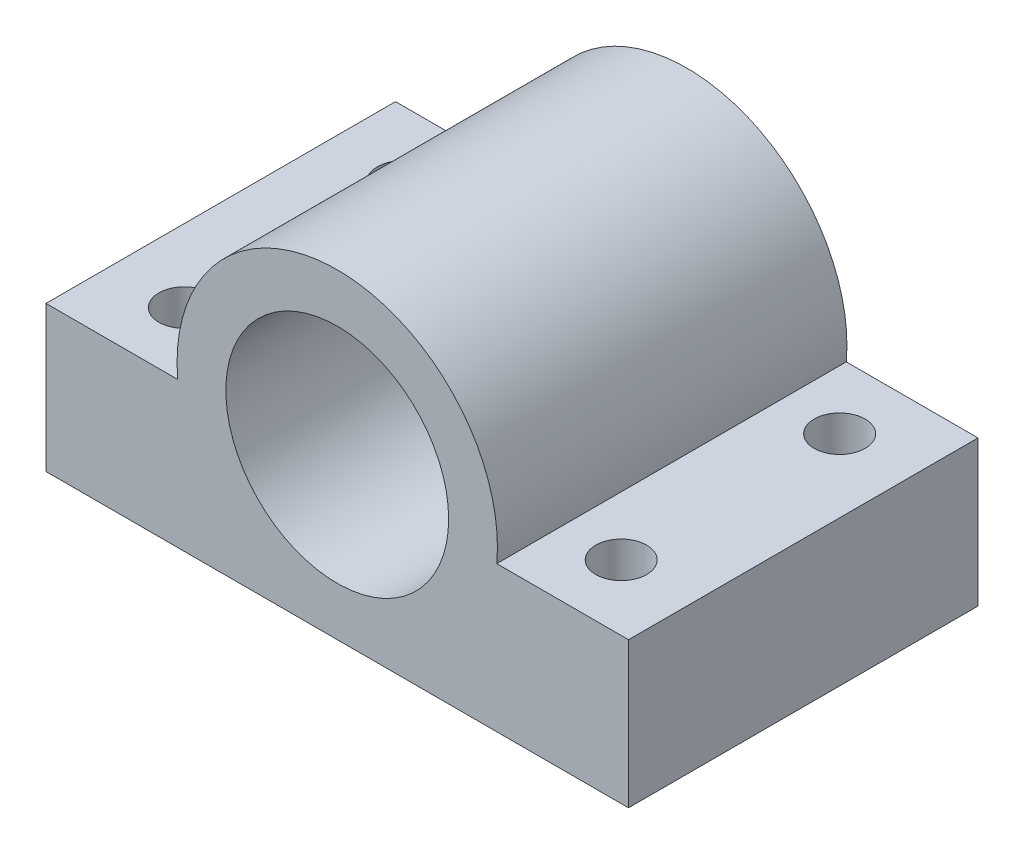
from build123d import *

# Parameters (mm, degrees)
ESBO_O1_R                = 7.65
RESSALTO_EXTRUS_O1_DEPTH = 24
ESBO_O2_R                = 1.75
CORTE_EXTRUS_O1_DEPTH    = 20


with BuildPart() as part:
    # Esboço1 → Ressalto-extrusão1 (new body)
    with BuildSketch(Plane.XY):
        with BuildLine():
            Line((-10.95445115, -1), (-20, -1))
            Line((-20, -1), (-20, -11))
            Line((-20, -11), (0, -11))
            Line((0, -11), (20, -11))
            Line((20, -11), (20, -1))
            Line((20, -1), (10.95445115, -1))
            ThreePointArc((10.95445115, -1), (0, 11), (-10.95445115, -1))
        make_face()
        Circle(ESBO_O1_R, mode=Mode.SUBTRACT)
    extrude(amount=RESSALTO_EXTRUS_O1_DEPTH)

    # Esboço2 → Corte-extrusão1 (cut)
    with BuildSketch(Plane.XZ.offset(11)):
        with Locations(Location((15, 19.5, 0), (0, 0, 270))):
            Circle(ESBO_O2_R)
        with Locations(Location((15, 4.5, 0), (0, 0, 270))):
            Circle(ESBO_O2_R)
        with Locations(Location((-15, 4.5, 0), (0, 0, 270))):
            Circle(ESBO_O2_R)
        with Locations(Location((-15, 19.5, 0), (0, 0, 270))):
            Circle(ESBO_O2_R)
    extrude(amount=-CORTE_EXTRUS_O1_DEPTH, mode=Mode.SUBTRACT)


solid = part.part
